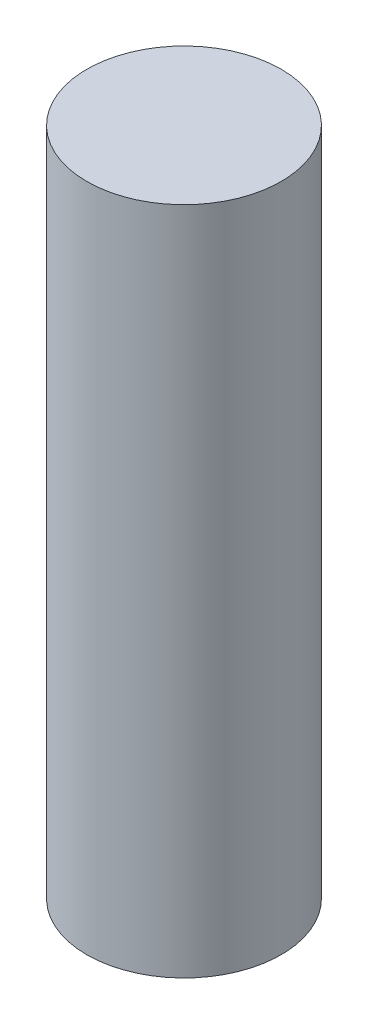
from build123d import *

# Parameters (mm, degrees)
SKETCH1_R           = 3.683
BOSS_EXTRUDE1_DEPTH = 25.372143043


with BuildPart() as part:
    # Sketch1 → Boss-Extrude1 (new body)
    with BuildSketch(Plane(origin=(0, 0, 0), x_dir=(1, 0, 0), z_dir=(0, 1, 0))):
        with Locations(Location((0, 0, 0), (0, 0, 270))):
            Circle(SKETCH1_R)
    extrude(amount=BOSS_EXTRUDE1_DEPTH)


solid = part.part
